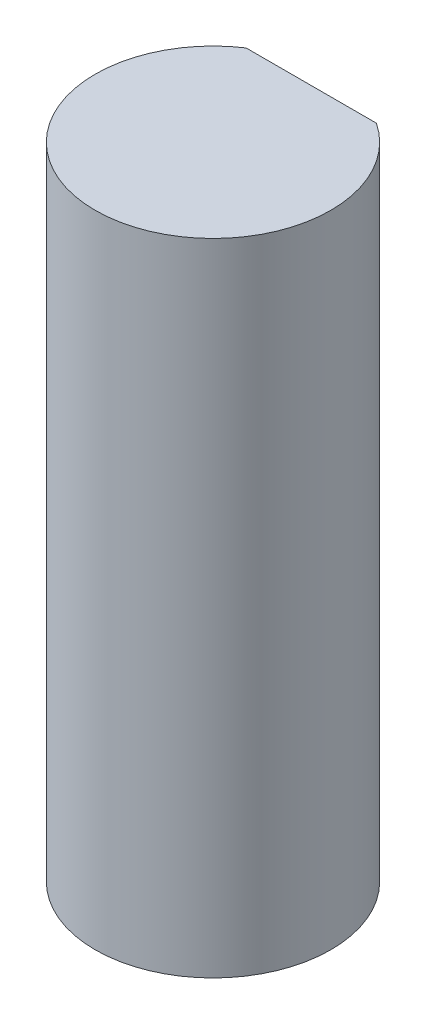
from build123d import *

# Parameters (mm, degrees)
SKETCH_1_R          = 3
EXTRUDE_1_DEPTH     = 16.3
CUT_EXTRUDE_START   = -12
CUT_EXTRUDE_1_DEPTH = 12


with BuildPart() as part:
    # Эскиз1 → Бобышка-Вытянуть1 (new body)
    with BuildSketch(Plane(origin=(0, 0, 0), x_dir=(1, 0, 0), z_dir=(0, 1, 0))):
        with Locations(Location((0, 0, 0), (0, 0, 270))):
            Circle(SKETCH_1_R)
    extrude(amount=EXTRUDE_1_DEPTH)

    # Эскиз2 → Вырез-Вытянуть1 (cut)
    with BuildSketch(Plane(origin=(0, 16.3, 0), x_dir=(1, 0, 0), z_dir=(0, 1, 0)).offset(CUT_EXTRUDE_START)):
        with BuildLine():
            Line((-1.658312395, 2.5), (1.658312395, 2.5))
            ThreePointArc((1.658312395, 2.5), (0, 3), (-1.658312395, 2.5))
        make_face()
    extrude(amount=CUT_EXTRUDE_1_DEPTH, mode=Mode.SUBTRACT)


solid = part.part
